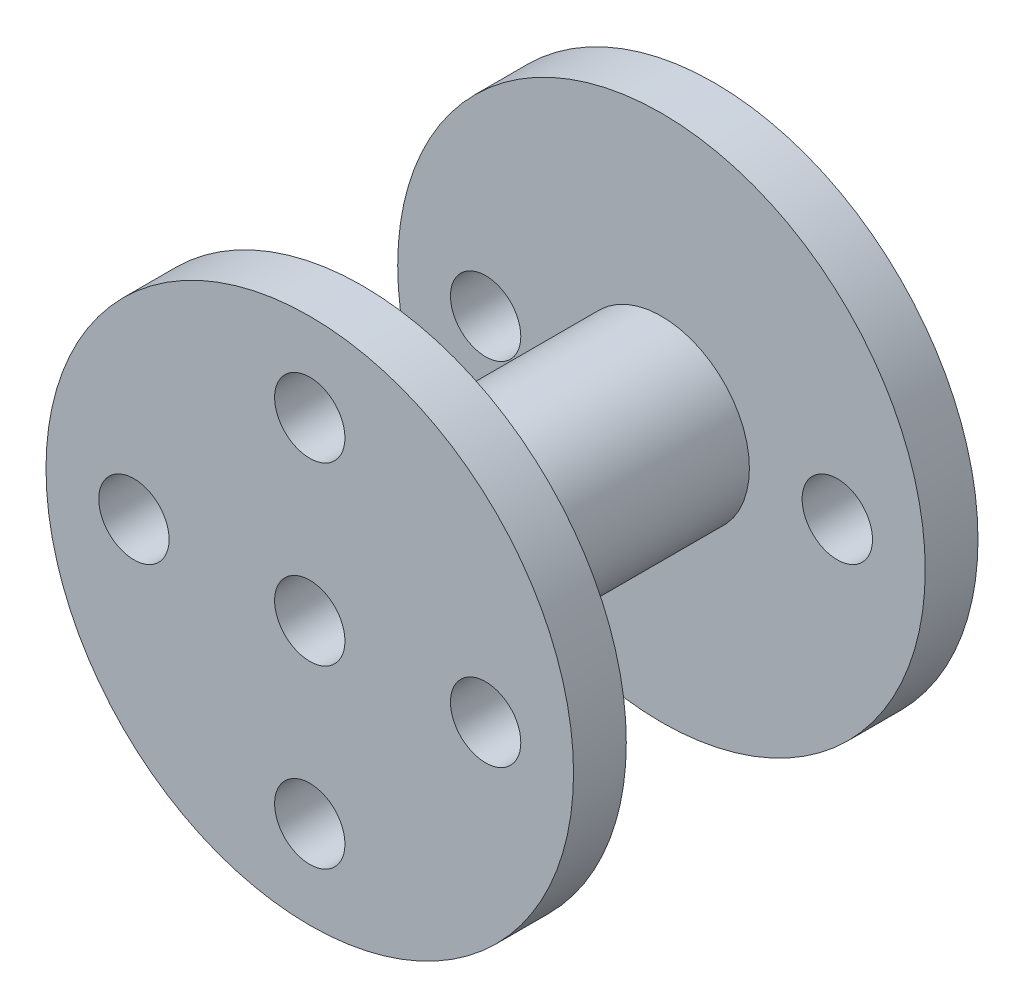
from build123d import *

# Parameters (mm, degrees)
SKETCH_1_R          = 15
SKETCH_1_R_2        = 2
EXTRUDE_2_DEPTH     = 3
SKETCH_2_R          = 5
EXTRUDE_3_DEPTH     = 17
SKETCH_4_R          = 15
SKETCH_4_R_2        = 2
EXTRUDE_4_DEPTH     = 3
SKETCH_8_R          = 2
CUT_EXTRUDE_2_DEPTH = 15


with BuildPart() as part:
    # 草图1 → 凸台-拉伸2 (new body)
    with BuildSketch(Plane.XY):
        Circle(SKETCH_1_R)
        with Locations((10, 0)):
            Circle(SKETCH_1_R_2, mode=Mode.SUBTRACT)
        with Locations((-10, 0)):
            Circle(SKETCH_1_R_2, mode=Mode.SUBTRACT)
    extrude(amount=EXTRUDE_2_DEPTH)

    # 草图2 → 凸台-拉伸3 (add)
    with BuildSketch(Plane.XY.offset(3)):
        Circle(SKETCH_2_R)
    extrude(amount=EXTRUDE_3_DEPTH)

    # 草图4 → 凸台-拉伸4 (add)
    with BuildSketch(Plane.XY.offset(20)):
        Circle(SKETCH_4_R)
        with Locations((-10, 0)):
            Circle(SKETCH_4_R_2, mode=Mode.SUBTRACT)
        with Locations((0, 10)):
            Circle(SKETCH_4_R_2, mode=Mode.SUBTRACT)
        with Locations((10, 0)):
            Circle(SKETCH_4_R_2, mode=Mode.SUBTRACT)
        with Locations((0, -10)):
            Circle(SKETCH_4_R_2, mode=Mode.SUBTRACT)
    extrude(amount=EXTRUDE_4_DEPTH)

    # 草图8 → 切除-拉伸2 (cut)
    with BuildSketch(Plane.XY.offset(23)):
        Circle(SKETCH_8_R)
    extrude(amount=-CUT_EXTRUDE_2_DEPTH, mode=Mode.SUBTRACT)


solid = part.part
